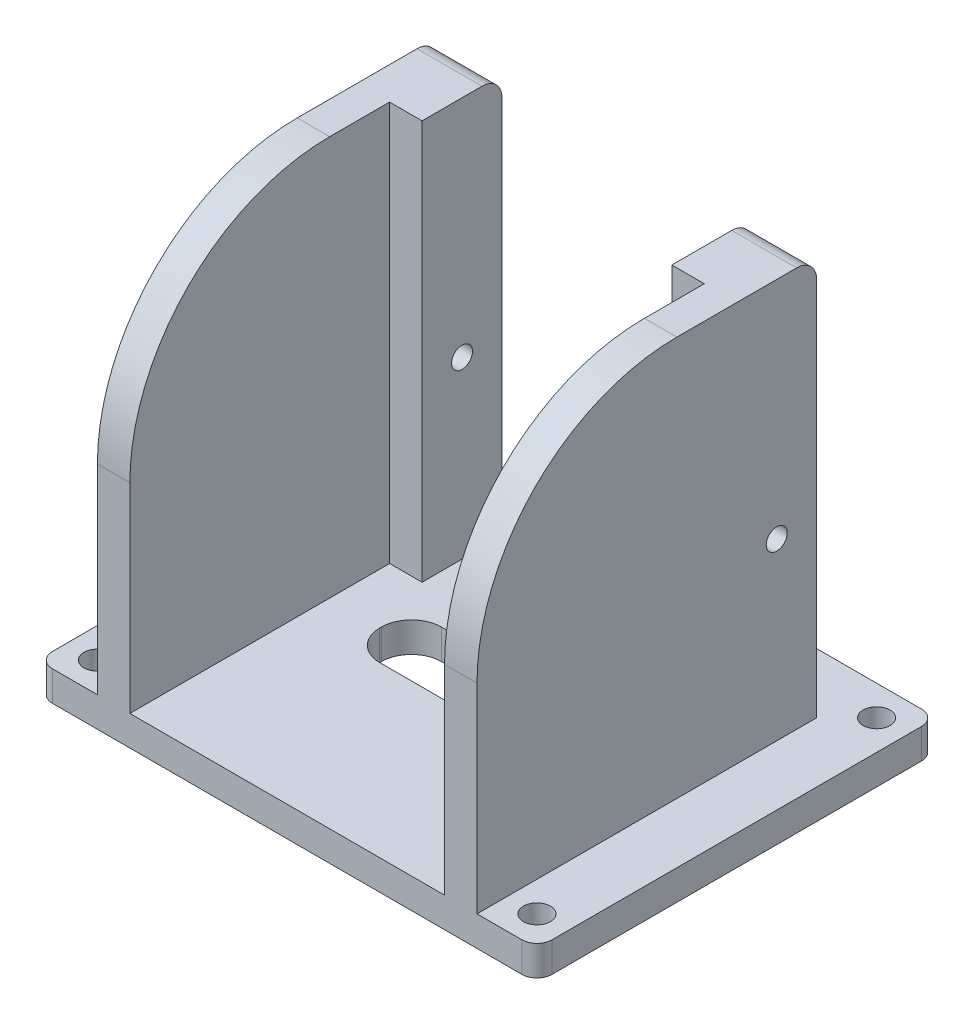
from build123d import *

# Parameters (mm, degrees)
DODANIE_WYCI_GNI_CIE1_DEPTH     = 3
SZKIC2_R                        = 1.35
WYTNIJ_WYCI_GNI_CIE1_DEPTH      = 3
DODANIE_WYCI_GNI_CIE2_DEPTH     = 40
WYTNIJ_WYCI_GNI_CIE4_DEPTH      = 65.691575959
WYTNIJ_WYCI_GNI_CIE4_DEPTH_BACK = 65.691575959
SZKIC6_R                        = 1.05
ZAOKR_GLENIE8_R                 = 20
ZAOKR_GLENIE9_R                 = 20
ZAOKR_GLENIE10_R                = 2
ZAOKR_GLENIE11_R                = 2


with BuildPart() as part:
    # Szkic1 → Dodanie-wyciągnięcie1 (new body)
    with BuildSketch(Plane(origin=(0, 0, 0), x_dir=(1, 0, 0), z_dir=(0, 1, 0))):
        with BuildLine():
            Line((-23.5, -20), (23.5, -20))
            ThreePointArc((23.5, -20), (24.560660172, -19.560660172), (25, -18.5))
            Line((25, -18.5), (25, 18.5))
            ThreePointArc((25, 18.5), (24.560660172, 19.560660172), (23.5, 20))
            Line((23.5, 20), (-23.5, 20))
            ThreePointArc((-23.5, 20), (-24.560660172, 19.560660172), (-25, 18.5))
            Line((-25, 18.5), (-25, -18.5))
            ThreePointArc((-25, -18.5), (-24.560660172, -19.560660172), (-23.5, -20))
        make_face()
    extrude(amount=DODANIE_WYCI_GNI_CIE1_DEPTH)

    # Szkic2 → Wytnij-wyciągnięcie1 (cut)
    with BuildSketch(Plane(origin=(0, 3, 0), x_dir=(1, 0, 0), z_dir=(0, 1, 0))):
        with Locations(Location((-22, 17, 0), (0, 0, 270))):
            Circle(SZKIC2_R)
        with Locations(Location((22, 17, 0), (0, 0, 270))):
            Circle(SZKIC2_R)
        with Locations(Location((-22, -17, 0), (0, 0, 270))):
            Circle(SZKIC2_R)
        with Locations(Location((22, -17, 0), (0, 0, 270))):
            Circle(SZKIC2_R)
        with BuildLine():
            Line((7.65, -3.086345678), (-7.65, -3.086345678))
            ThreePointArc((-7.65, -3.086345678), (-9.771320344, -2.207666021), (-10.65, -0.086345678))
            Line((-10.65, -0.086345678), (-10.65, 0.086345678))
            ThreePointArc((-10.65, 0.086345678), (-9.771320344, 2.207666021), (-7.65, 3.086345678))
            Line((-7.65, 3.086345678), (7.65, 3.086345678))
            ThreePointArc((7.65, 3.086345678), (9.771320344, 2.207666021), (10.65, 0.086345678))
            Line((10.65, 0.086345678), (10.65, -0.086345678))
            ThreePointArc((10.65, -0.086345678), (9.771320344, -2.207666021), (7.65, -3.086345678))
        make_face()
    extrude(amount=-WYTNIJ_WYCI_GNI_CIE1_DEPTH, mode=Mode.SUBTRACT)

    # Szkic3 → Dodanie-wyciągnięcie2 (add)
    with BuildSketch(Plane(origin=(0, 3, 0), x_dir=(1, 0, 0), z_dir=(0, 1, 0))):
        Polygon((-15.75, 6), (-12.5, 6), (-12.5, 14), (-19, 14), (-19, -20), (-15.75, -20), align=None)
        Polygon((15.75, 6), (15.75, -20), (19, -20), (19, 14), (12.5, 14), (12.5, 6), align=None)
    extrude(amount=DODANIE_WYCI_GNI_CIE2_DEPTH)

    # Szkic6 → Wytnij-wyciągnięcie4 (cut, two sides: drawn at the far end of the back side and taken through both)
    with BuildSketch(Plane.ZY.offset(19).offset(-WYTNIJ_WYCI_GNI_CIE4_DEPTH_BACK)):
        with Locations((-10, 20.5)):
            Circle(SZKIC6_R)
    extrude(amount=WYTNIJ_WYCI_GNI_CIE4_DEPTH + WYTNIJ_WYCI_GNI_CIE4_DEPTH_BACK, mode=Mode.SUBTRACT)

    # Zaokrąglenie8
    zaokr_glenie8_edges = [part.edges().sort_by_distance(p)[0] for p in [
        (-17.375, 43, 20),
    ]]
    fillet(zaokr_glenie8_edges, radius=ZAOKR_GLENIE8_R)

    # Zaokrąglenie9
    zaokr_glenie9_edges = [part.edges().sort_by_distance(p)[0] for p in [
        (17.375, 43, 20),
    ]]
    fillet(zaokr_glenie9_edges, radius=ZAOKR_GLENIE9_R)

    # Zaokrąglenie10
    zaokr_glenie10_edges = [part.edges().sort_by_distance(p)[0] for p in [
        (-15.75, 43, -14),
    ]]
    fillet(zaokr_glenie10_edges, radius=ZAOKR_GLENIE10_R)

    # Zaokrąglenie11
    zaokr_glenie11_edges = [part.edges().sort_by_distance(p)[0] for p in [
        (15.75, 43, -14),
    ]]
    fillet(zaokr_glenie11_edges, radius=ZAOKR_GLENIE11_R)


solid = part.part
